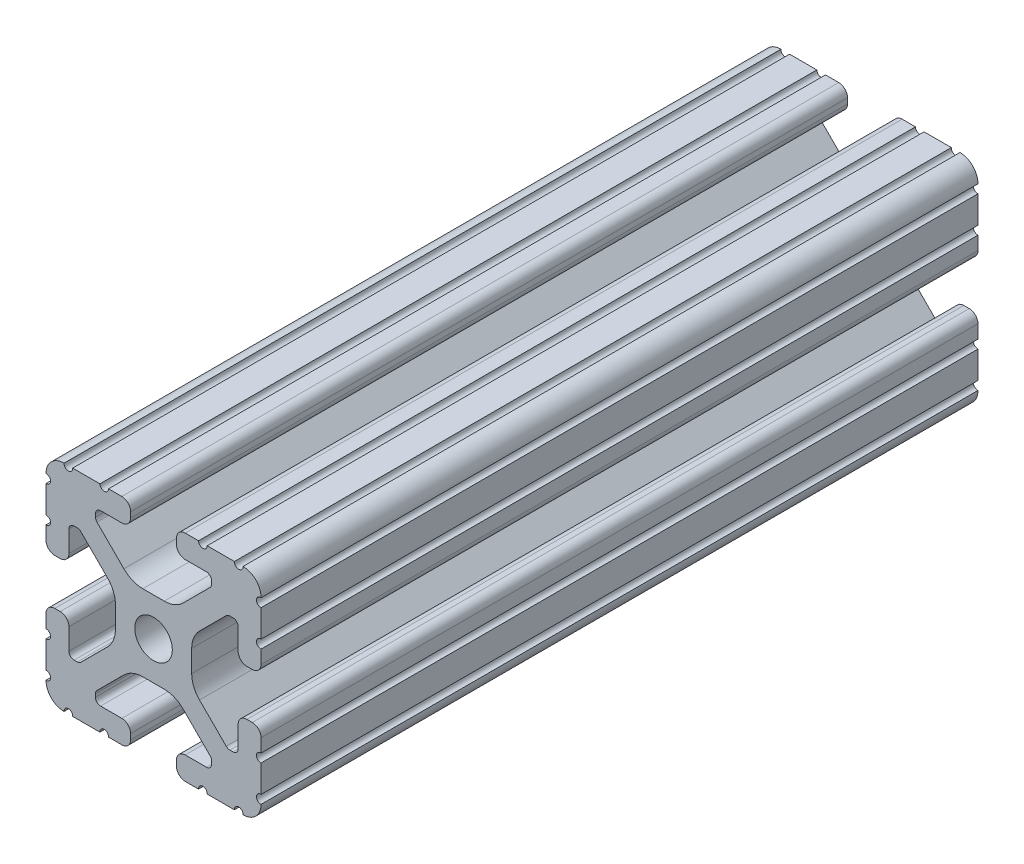
from build123d import *

# Parameters (mm, degrees)
SKETCH1_R      = 3.3274
EXTRUDE1_DEPTH = 127


with BuildPart() as part:
    # Sketch1 → Extrude1 (new body)
    with BuildSketch(Plane.XY):
        with BuildLine():
            Line((-10.022898969, 12.91475973), (-5.252158105, 8.144007132))
            ThreePointArc((-5.252158105, 8.144007132), (-3.715177372, 7.117027388), (-1.902183975, 6.7564))
            Line((-1.902183975, 6.7564), (1.902183975, 6.7564))
            ThreePointArc((1.902183975, 6.7564), (3.715177372, 7.117027388), (5.252158105, 8.144007132))
            Line((5.252158105, 8.144007132), (10.022898969, 12.91475973))
            ThreePointArc((10.022898969, 12.91475973), (10.218362387, 13.207291992), (10.287, 13.552357131))
            Line((10.287, 13.552357131), (10.287, 14.0843))
            ThreePointArc((10.287, 14.0843), (10.022898185, 14.721898185), (9.3853, 14.986))
            Line((9.3853, 14.986), (5.617617549, 14.986))
            ThreePointArc((5.617617549, 14.986), (4.519044045, 15.441044045), (4.064, 16.539617549))
            Line((4.064, 16.539617549), (4.064, 17.496382451))
            ThreePointArc((4.064, 17.496382451), (4.519044045, 18.594955955), (5.617617549, 19.05))
            Line((5.617617549, 19.05), (7.974178704, 19.05))
            ThreePointArc((7.974178704, 19.05), (8.736178704, 18.288), (9.498178704, 19.05))
            Line((9.498178704, 19.05), (14.327719207, 19.05))
            ThreePointArc((14.327719207, 19.05), (15.087603123, 18.231251131), (15.847487039, 19.05))
            ThreePointArc((15.847487039, 19.05), (18.120176289, 18.120192083), (19.05, 15.847509295))
            ThreePointArc((19.05, 15.847509295), (18.231250992, 15.08762539), (19.05, 14.327741484))
            Line((19.05, 14.327741484), (19.05, 9.496091471))
            ThreePointArc((19.05, 9.496091471), (18.231250992, 8.736207565), (19.05, 7.97632366))
            Line((19.05, 7.97632366), (19.05, 5.617617549))
            ThreePointArc((19.05, 5.617617549), (18.594955955, 4.519044045), (17.496382451, 4.064))
            Line((17.496382451, 4.064), (16.539617549, 4.064))
            ThreePointArc((16.539617549, 4.064), (15.441044045, 4.519044045), (14.986, 5.617617549))
            Line((14.986, 5.617617549), (14.986, 9.385342516))
            ThreePointArc((14.986, 9.385342516), (14.721898185, 10.022940701), (14.0843, 10.287042516))
            Line((14.0843, 10.287042516), (13.516042086, 10.287042516))
            ThreePointArc((13.516042086, 10.287042516), (13.170975923, 10.218404478), (12.878443117, 10.022939917))
            Line((12.878443117, 10.022939917), (8.14758008, 5.292065243))
            ThreePointArc((8.14758008, 5.292065243), (7.117955879, 3.751120653), (6.7564, 1.933453584))
            Line((6.7564, 1.933453584), (6.7564, -1.933453584))
            ThreePointArc((6.7564, -1.933453584), (7.117955879, -3.751120653), (8.14758008, -5.292065243))
            Line((8.14758008, -5.292065243), (12.878443117, -10.022939917))
            ThreePointArc((12.878443117, -10.022939917), (13.170975923, -10.218404478), (13.516042086, -10.287042516))
            Line((13.516042086, -10.287042516), (14.0843, -10.287042516))
            ThreePointArc((14.0843, -10.287042516), (14.721898185, -10.022940701), (14.986, -9.385342516))
            Line((14.986, -9.385342516), (14.986, -5.617617549))
            ThreePointArc((14.986, -5.617617549), (15.441044045, -4.519044045), (16.539617549, -4.064))
            Line((16.539617549, -4.064), (17.496382451, -4.064))
            ThreePointArc((17.496382451, -4.064), (18.594955955, -4.519044045), (19.05, -5.617617549))
            Line((19.05, -5.617617549), (19.05, -7.976318491))
            ThreePointArc((19.05, -7.976318491), (18.231250992, -8.736202396), (19.05, -9.496086302))
            Line((19.05, -9.496086302), (19.05, -14.32774291))
            ThreePointArc((19.05, -14.32774291), (18.231250992, -15.087626816), (19.05, -15.847510721))
            ThreePointArc((19.05, -15.847510721), (18.120175716, -18.120192644), (15.847486868, -19.05))
            ThreePointArc((15.847486868, -19.05), (15.087602952, -18.231251131), (14.327719036, -19.05))
            Line((14.327719036, -19.05), (9.496062448, -19.05))
            ThreePointArc((9.496062448, -19.05), (8.736178532, -18.231251131), (7.976294616, -19.05))
            Line((7.976294616, -19.05), (5.617617549, -19.05))
            ThreePointArc((5.617617549, -19.05), (4.519044045, -18.594955955), (4.064, -17.496382451))
            Line((4.064, -17.496382451), (4.064, -16.539617549))
            ThreePointArc((4.064, -16.539617549), (4.519044045, -15.441044045), (5.617617549, -14.986))
            Line((5.617617549, -14.986), (9.3853, -14.986))
            ThreePointArc((9.3853, -14.986), (10.022898185, -14.721898185), (10.287, -14.0843))
            Line((10.287, -14.0843), (10.287, -13.552357131))
            ThreePointArc((10.287, -13.552357131), (10.218362387, -13.207291992), (10.022898969, -12.91475973))
            Line((10.022898969, -12.91475973), (5.252158105, -8.144007132))
            ThreePointArc((5.252158105, -8.144007132), (3.715177372, -7.117027388), (1.902183975, -6.7564))
            Line((1.902183975, -6.7564), (-1.902183975, -6.7564))
            ThreePointArc((-1.902183975, -6.7564), (-3.715177372, -7.117027388), (-5.252158105, -8.144007132))
            Line((-5.252158105, -8.144007132), (-10.022898969, -12.91475973))
            ThreePointArc((-10.022898969, -12.91475973), (-10.218362387, -13.207291992), (-10.287, -13.552357131))
            Line((-10.287, -13.552357131), (-10.287, -14.0843))
            ThreePointArc((-10.287, -14.0843), (-10.022898185, -14.721898185), (-9.3853, -14.986))
            Line((-9.3853, -14.986), (-5.617617549, -14.986))
            ThreePointArc((-5.617617549, -14.986), (-4.519044045, -15.441044045), (-4.064, -16.539617549))
            Line((-4.064, -16.539617549), (-4.064, -17.496382451))
            ThreePointArc((-4.064, -17.496382451), (-4.519044045, -18.594955955), (-5.617617549, -19.05))
            Line((-5.617617549, -19.05), (-7.976294616, -19.05))
            ThreePointArc((-7.976294616, -19.05), (-8.736178532, -18.231251131), (-9.496062448, -19.05))
            Line((-9.496062448, -19.05), (-14.327719036, -19.05))
            ThreePointArc((-14.327719036, -19.05), (-15.087602952, -18.231251131), (-15.847486868, -19.05))
            ThreePointArc((-15.847486868, -19.05), (-18.120175716, -18.120192644), (-19.05, -15.847510721))
            ThreePointArc((-19.05, -15.847510721), (-18.231250992, -15.087626816), (-19.05, -14.32774291))
            Line((-19.05, -14.32774291), (-19.05, -9.496086302))
            ThreePointArc((-19.05, -9.496086302), (-18.231250992, -8.736202396), (-19.05, -7.976318491))
            Line((-19.05, -7.976318491), (-19.05, -5.617617549))
            ThreePointArc((-19.05, -5.617617549), (-18.594955955, -4.519044045), (-17.496382451, -4.064))
            Line((-17.496382451, -4.064), (-16.539617549, -4.064))
            ThreePointArc((-16.539617549, -4.064), (-15.441044045, -4.519044045), (-14.986, -5.617617549))
            Line((-14.986, -5.617617549), (-14.986, -9.385342516))
            ThreePointArc((-14.986, -9.385342516), (-14.721898185, -10.022940701), (-14.0843, -10.287042516))
            Line((-14.0843, -10.287042516), (-13.516042086, -10.287042516))
            ThreePointArc((-13.516042086, -10.287042516), (-13.170975923, -10.218404478), (-12.878443117, -10.022939917))
            Line((-12.878443117, -10.022939917), (-8.14758008, -5.292065243))
            ThreePointArc((-8.14758008, -5.292065243), (-7.117955879, -3.751120653), (-6.7564, -1.933453584))
            Line((-6.7564, -1.933453584), (-6.7564, 1.933453584))
            ThreePointArc((-6.7564, 1.933453584), (-7.117955879, 3.751120653), (-8.14758008, 5.292065243))
            Line((-8.14758008, 5.292065243), (-12.878443117, 10.022939917))
            ThreePointArc((-12.878443117, 10.022939917), (-13.170975923, 10.218404478), (-13.516042086, 10.287042516))
            Line((-13.516042086, 10.287042516), (-14.0843, 10.287042516))
            ThreePointArc((-14.0843, 10.287042516), (-14.721898185, 10.022940701), (-14.986, 9.385342516))
            Line((-14.986, 9.385342516), (-14.986, 5.617617549))
            ThreePointArc((-14.986, 5.617617549), (-15.441044045, 4.519044045), (-16.539617549, 4.064))
            Line((-16.539617549, 4.064), (-17.496382451, 4.064))
            ThreePointArc((-17.496382451, 4.064), (-18.594955955, 4.519044045), (-19.05, 5.617617549))
            Line((-19.05, 5.617617549), (-19.05, 7.97632366))
            ThreePointArc((-19.05, 7.97632366), (-18.231250992, 8.736207565), (-19.05, 9.496091471))
            Line((-19.05, 9.496091471), (-19.05, 14.327741484))
            ThreePointArc((-19.05, 14.327741484), (-18.231250992, 15.08762539), (-19.05, 15.847509295))
            ThreePointArc((-19.05, 15.847509295), (-18.120176289, 18.120192083), (-15.847487039, 19.05))
            ThreePointArc((-15.847487039, 19.05), (-15.087603123, 18.231251131), (-14.327719207, 19.05))
            Line((-14.327719207, 19.05), (-9.498178704, 19.05))
            ThreePointArc((-9.498178704, 19.05), (-8.736178704, 18.288), (-7.974178704, 19.05))
            Line((-7.974178704, 19.05), (-5.617617549, 19.05))
            ThreePointArc((-5.617617549, 19.05), (-4.519044045, 18.594955955), (-4.064, 17.496382451))
            Line((-4.064, 17.496382451), (-4.064, 16.539617549))
            ThreePointArc((-4.064, 16.539617549), (-4.519044045, 15.441044045), (-5.617617549, 14.986))
            Line((-5.617617549, 14.986), (-9.3853, 14.986))
            ThreePointArc((-9.3853, 14.986), (-10.022898185, 14.721898185), (-10.287, 14.0843))
            Line((-10.287, 14.0843), (-10.287, 13.552357131))
            ThreePointArc((-10.287, 13.552357131), (-10.218362387, 13.207291992), (-10.022898969, 12.91475973))
        make_face()
        Circle(SKETCH1_R, mode=Mode.SUBTRACT)
    extrude(amount=-EXTRUDE1_DEPTH)


solid = part.part
